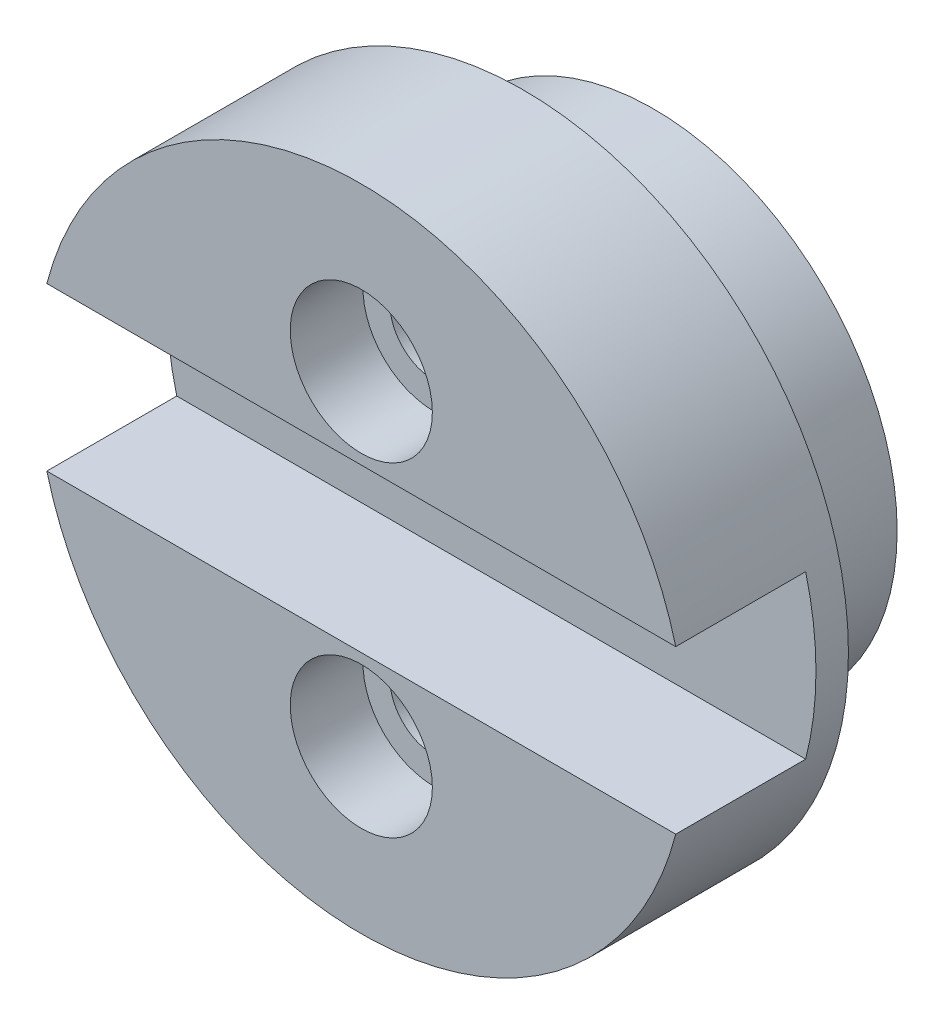
from build123d import *

# Parameters (mm, degrees)
SKETCH1_R                                      = 9.525
BOSS_EXTRUDE1_DEPTH                            = 5.08
SKETCH2_R                                      = 12.7
BOSS_EXTRUDE2_DEPTH                            = 6.35
SKETCH3_W                                      = 25.4
SKETCH3_H                                      = 6.35
CUT_EXTRUDE1_DEPTH                             = 5.08
CBORE_FOR_4_SOCKET_HEAD_CAP_SCREW1_D           = 3.4544
CBORE_FOR_4_SOCKET_HEAD_CAP_SCREW1_CBORE_D     = 5.55752
CBORE_FOR_4_SOCKET_HEAD_CAP_SCREW1_CBORE_DEPTH = 2.8448


with BuildPart() as part:
    # Sketch1 → Boss-Extrude1 (new body)
    with BuildSketch(Plane.XY):
        Circle(SKETCH1_R)
    extrude(amount=BOSS_EXTRUDE1_DEPTH)

    # Sketch2 → Boss-Extrude2 (add)
    with BuildSketch(Plane.XY.offset(5.08)):
        Circle(SKETCH2_R)
    extrude(amount=BOSS_EXTRUDE2_DEPTH)

    # Sketch3 → Cut-Extrude1 (cut)
    with BuildSketch(Plane.XY.offset(11.43)):
        Rectangle(SKETCH3_W, SKETCH3_H)
    extrude(amount=-CUT_EXTRUDE1_DEPTH, mode=Mode.SUBTRACT)

    # CBORE for #4 Socket Head Cap Screw1 (through all)
    with Locations(Plane.XY.offset(11.43)):
        with Locations((0, -6.35), (0, 6.35)):
            CounterBoreHole(CBORE_FOR_4_SOCKET_HEAD_CAP_SCREW1_D / 2, CBORE_FOR_4_SOCKET_HEAD_CAP_SCREW1_CBORE_D / 2, CBORE_FOR_4_SOCKET_HEAD_CAP_SCREW1_CBORE_DEPTH)


solid = part.part
